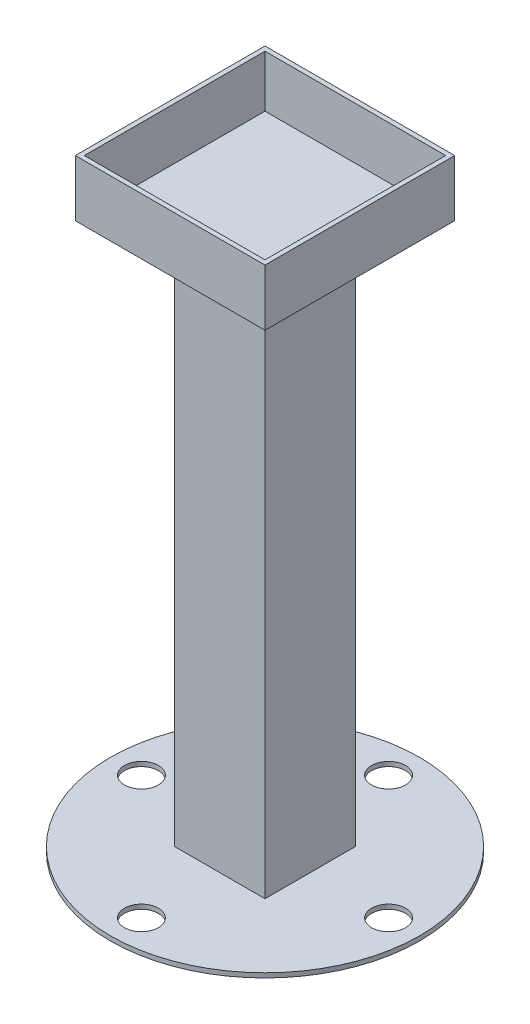
from build123d import *

# Parameters (mm, degrees)
SKETCH1_R           = 86.9315
BOSS_EXTRUDE1_DEPTH = 2.54
SKETCH2_W           = 50.8
SKETCH2_H           = 50.8
BOSS_EXTRUDE2_DEPTH = 304.8
SKETCH3_W           = 106.68
SKETCH3_H           = 106.68
BOSS_EXTRUDE4_DEPTH = 31.75
SKETCH4_W           = 101.6
SKETCH4_H           = 101.6
CUT_EXTRUDE1_DEPTH  = 29.21
SKETCH6_R           = 9.525
CUT_EXTRUDE3_DEPTH  = 29.21


with BuildPart() as part:
    # Sketch1 → Boss-Extrude1 (new body)
    with BuildSketch(Plane(origin=(0, 0, 0), x_dir=(1, 0, 0), z_dir=(0, 1, 0))):
        with Locations(Location((0, 0, 0), (0, 0, 270))):
            Circle(SKETCH1_R)
    extrude(amount=BOSS_EXTRUDE1_DEPTH)

    # Sketch2 → Boss-Extrude2 (add)
    with BuildSketch(Plane(origin=(0, 2.54, 0), x_dir=(1, 0, 0), z_dir=(0, 1, 0))):
        Rectangle(SKETCH2_W, SKETCH2_H)
    extrude(amount=BOSS_EXTRUDE2_DEPTH)

    # Sketch3 → Boss-Extrude4 (add)
    with BuildSketch(Plane(origin=(0, 307.34, 0), x_dir=(1, 0, 0), z_dir=(0, 1, 0))):
        Rectangle(SKETCH3_W, SKETCH3_H)
    extrude(amount=BOSS_EXTRUDE4_DEPTH)

    # Sketch4 → Cut-Extrude1 (cut)
    with BuildSketch(Plane(origin=(0, 339.09, 0), x_dir=(1, 0, 0), z_dir=(0, 1, 0))):
        Rectangle(SKETCH4_W, SKETCH4_H)
    extrude(amount=-CUT_EXTRUDE1_DEPTH, mode=Mode.SUBTRACT)

    # Sketch6 → Cut-Extrude3 (cut)
    with BuildSketch(Plane(origin=(0, 2.54, 0), x_dir=(1, 0, 0), z_dir=(0, 1, 0))):
        with Locations(Location((0, 69.50075, 0), (0, 0, 270))):
            Circle(SKETCH6_R)
        with Locations(Location((69.50075, 0, 0), (0, 0, 270))):
            Circle(SKETCH6_R)
        with Locations(Location((0, -69.50075, 0), (0, 0, 270))):
            Circle(SKETCH6_R)
        with Locations(Location((-69.50075, 0, 0), (0, 0, 270))):
            Circle(SKETCH6_R)
    extrude(amount=-CUT_EXTRUDE3_DEPTH, mode=Mode.SUBTRACT)


solid = part.part
